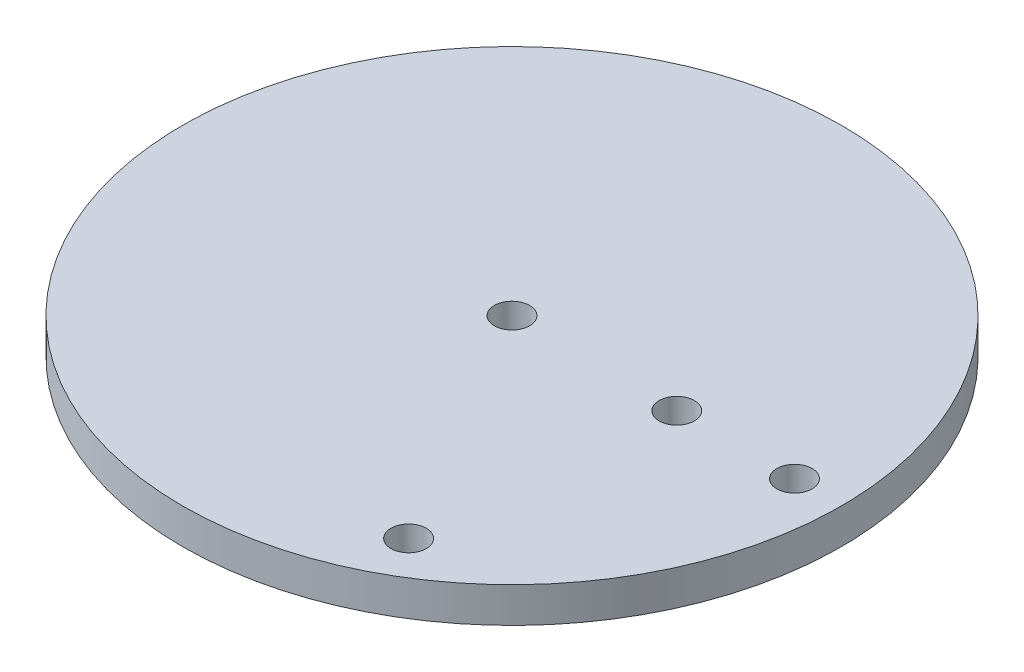
from build123d import *

# Parameters (mm, degrees)
SKETCH1_R           = 28
SKETCH1_R_2         = 1.5
BOSS_EXTRUDE1_DEPTH = 1.5


with BuildPart() as part:
    # Sketch1 → Boss-Extrude1 (new, symmetric)
    with BuildSketch(Plane(origin=(0, 0, 0), x_dir=(1, 0, 0), z_dir=(0, 1, 0))):
        with Locations(Location((0, 0, 0), (0, 0, 270))):
            Circle(SKETCH1_R)
        with Locations(Location((0, 0, 0), (0, 0, 270))):
            Circle(SKETCH1_R_2, mode=Mode.SUBTRACT)
        with Locations(Location((24, 0, 0), (0, 0, 270))):
            Circle(SKETCH1_R_2, mode=Mode.SUBTRACT)
        with Locations(Location((14, 0, 0), (0, 0, 270))):
            Circle(SKETCH1_R_2, mode=Mode.SUBTRACT)
        with Locations(Location((12, -20.784609691, 0), (0, 0, 270))):
            Circle(SKETCH1_R_2, mode=Mode.SUBTRACT)
    extrude(amount=BOSS_EXTRUDE1_DEPTH, both=True)


solid = part.part
